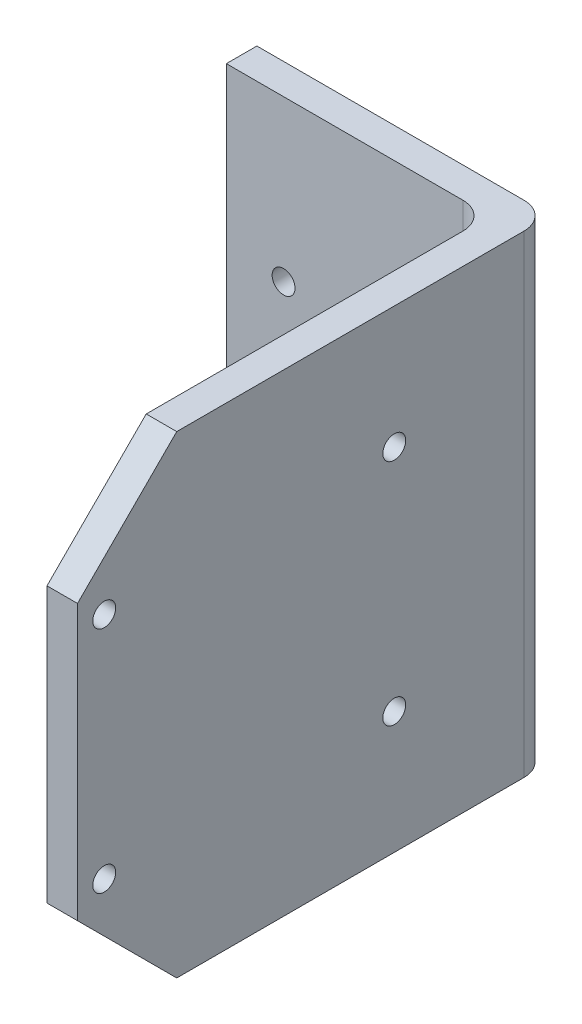
from build123d import *

# Parameters (mm, degrees)
EXTRUDE_1_DEPTH     = 31
SKETCH_2_R          = 1.5
CUT_EXTRUDE_2_DEPTH = 10
FILLET_1_R          = 3.5
FILLET_2_R          = 3.5
SKETCH_7_R          = 1.5
CUT_EXTRUDE_4_DEPTH = 10


with BuildPart() as part:
    # 草图1 → 凸台-拉伸1 (new, symmetric)
    with BuildSketch(Plane(origin=(0, 0, 0), x_dir=(1, 0, 0), z_dir=(0, 1, 0))):
        Polygon((-27.626027397, 43.157534247), (10.873972603, 43.157534247), (10.873972603, -18.842465753), (6.873972603, -18.842465753), (6.873972603, 39.157534247), (-27.626027397, 39.157534247), align=None)
    extrude(amount=EXTRUDE_1_DEPTH, both=True)

    # 草图2 → 切除-拉伸2 (cut)
    with BuildSketch(Plane(origin=(10.873972603, 0, 0), x_dir=(0, 0, -1), z_dir=(1, 0, 0))):
        Polygon((-5.842465753, 31), (-18.842465753, 31), (-18.842465753, 18), align=None)
        with Locations((22.657534247, -15)):
            Circle(SKETCH_2_R)
        Polygon((-5.842465753, -31), (-18.842465753, -18), (-18.842465753, -31), align=None)
        with Locations((22.657534247, 15)):
            Circle(SKETCH_2_R)
        with Locations((-15.342465753, 15)):
            Circle(SKETCH_2_R)
        with Locations((-15.342465753, -15)):
            Circle(SKETCH_2_R)
    extrude(amount=-CUT_EXTRUDE_2_DEPTH, mode=Mode.SUBTRACT)

    # 圆角1
    fillet_1_edges = [part.edges().sort_by_distance(p)[0] for p in [
        (10.873972603, 0, -43.157534247),
    ]]
    fillet(fillet_1_edges, radius=FILLET_1_R)

    # 圆角2
    fillet_2_edges = [part.edges().sort_by_distance(p)[0] for p in [
        (6.873972603, 0, -39.157534247),
    ]]
    fillet(fillet_2_edges, radius=FILLET_2_R)

    # 草图7 → 切除-拉伸4 (cut)
    with BuildSketch(Plane(origin=(0, 0, -43.157534247), x_dir=(-1, 0, 0), z_dir=(0, 0, -1))):
        with Locations((20.126027397, 10)):
            Circle(SKETCH_7_R)
        with Locations((20.126027397, -10)):
            Circle(SKETCH_7_R)
    extrude(amount=-CUT_EXTRUDE_4_DEPTH, mode=Mode.SUBTRACT)


solid = part.part
